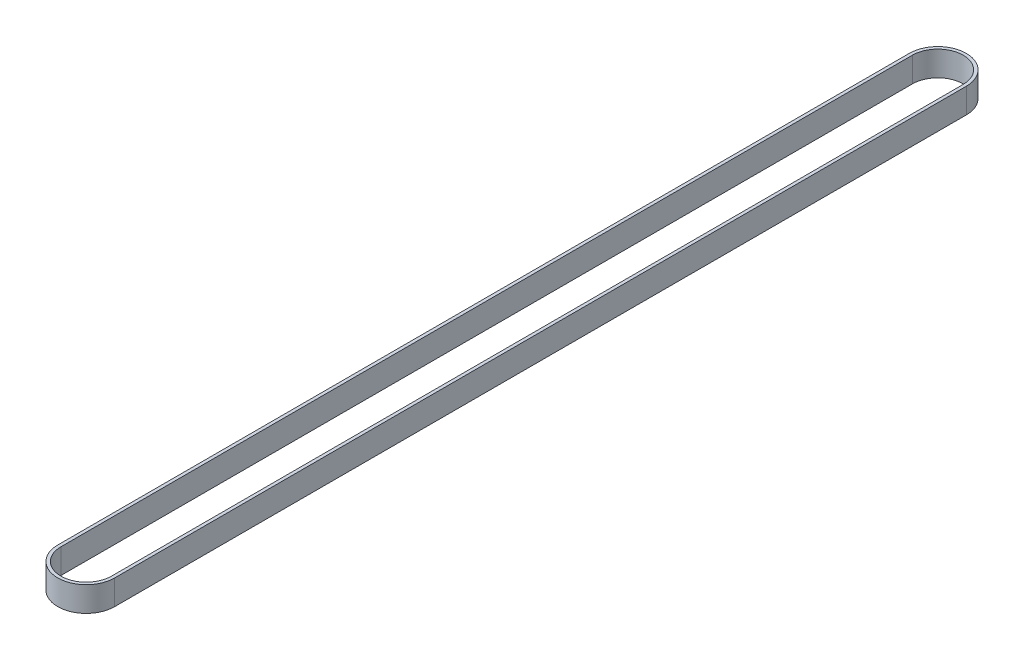
from build123d import *

# Parameters (mm, degrees)
EXTRUDE_1_DEPTH = 6


with BuildPart() as part:
    # 草图1 → 凸台-拉伸1 (new body)
    with BuildSketch(Plane(origin=(0, 0, 0), x_dir=(1, 0, 0), z_dir=(0, 1, 0))):
        with BuildLine():
            Line((-6.86, -102.55), (-6.86, 102.55))
            ThreePointArc((-6.86, 102.55), (0, 109.41), (6.86, 102.55))
            Line((6.86, 102.55), (6.86, -102.55))
            ThreePointArc((6.86, -102.55), (0, -109.41), (-6.86, -102.55))
        make_face()
        with BuildLine():
            Line((-6.11, -102.55), (-6.11, 102.55))
            ThreePointArc((-6.11, 102.55), (0, 108.66), (6.11, 102.55))
            Line((6.11, 102.55), (6.11, -102.55))
            ThreePointArc((6.11, -102.55), (0, -108.66), (-6.11, -102.55))
        make_face(mode=Mode.SUBTRACT)
    extrude(amount=EXTRUDE_1_DEPTH)


solid = part.part
